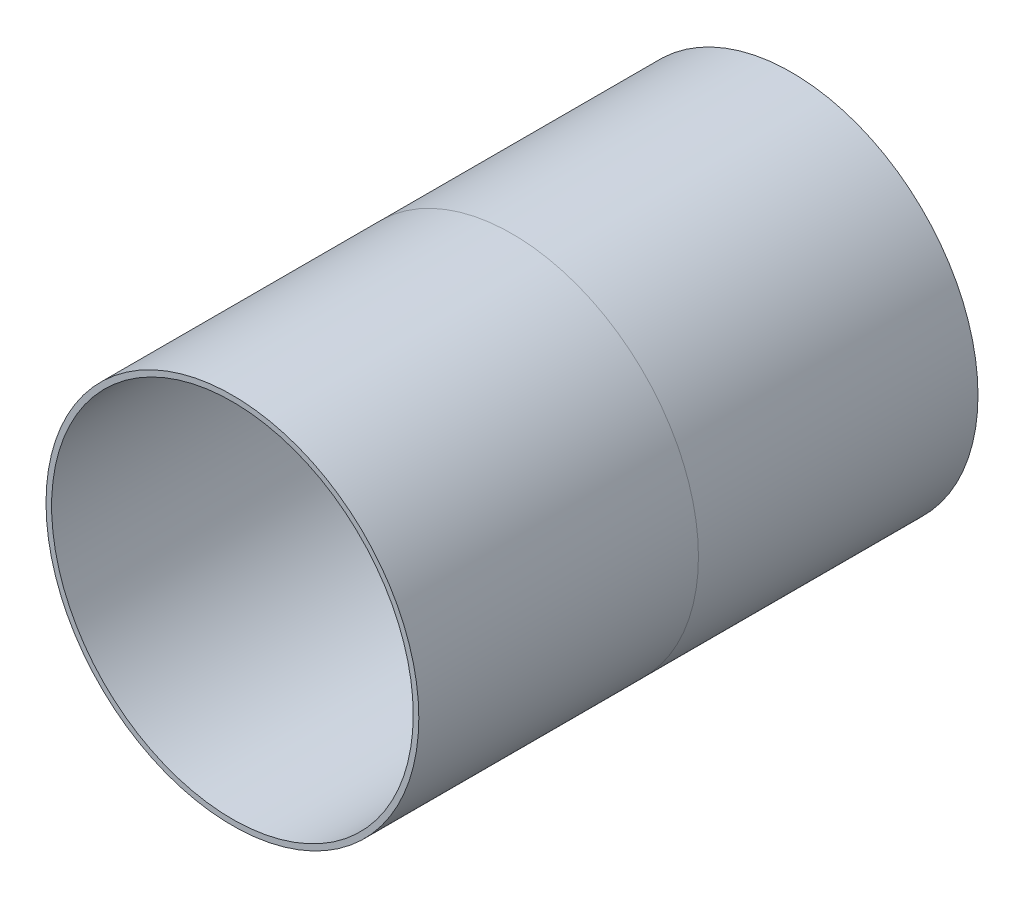
from build123d import *

# Parameters (mm, degrees)
ESQUISSE2_R        = 76.1746
ESQUISSE2_R_2      = 73.914
BOSS_EXTRU_1_DEPTH = 114.3
ESQUISSE3_R        = 76.2
ESQUISSE3_R_2      = 73.914
BOSS_EXTRU_2_DEPTH = 114.3


with BuildPart() as part:
    # Esquisse2 → Boss.-Extru.1 (new body)
    with BuildSketch(Plane.XY):
        Circle(ESQUISSE2_R)
        Circle(ESQUISSE2_R_2, mode=Mode.SUBTRACT)
    extrude(amount=BOSS_EXTRU_1_DEPTH)

    # Esquisse3 → Boss.-Extru.2 (add)
    with BuildSketch(Plane.XY.offset(114.3)):
        Circle(ESQUISSE3_R)
        Circle(ESQUISSE3_R_2, mode=Mode.SUBTRACT)
    extrude(amount=BOSS_EXTRU_2_DEPTH)


solid = part.part
